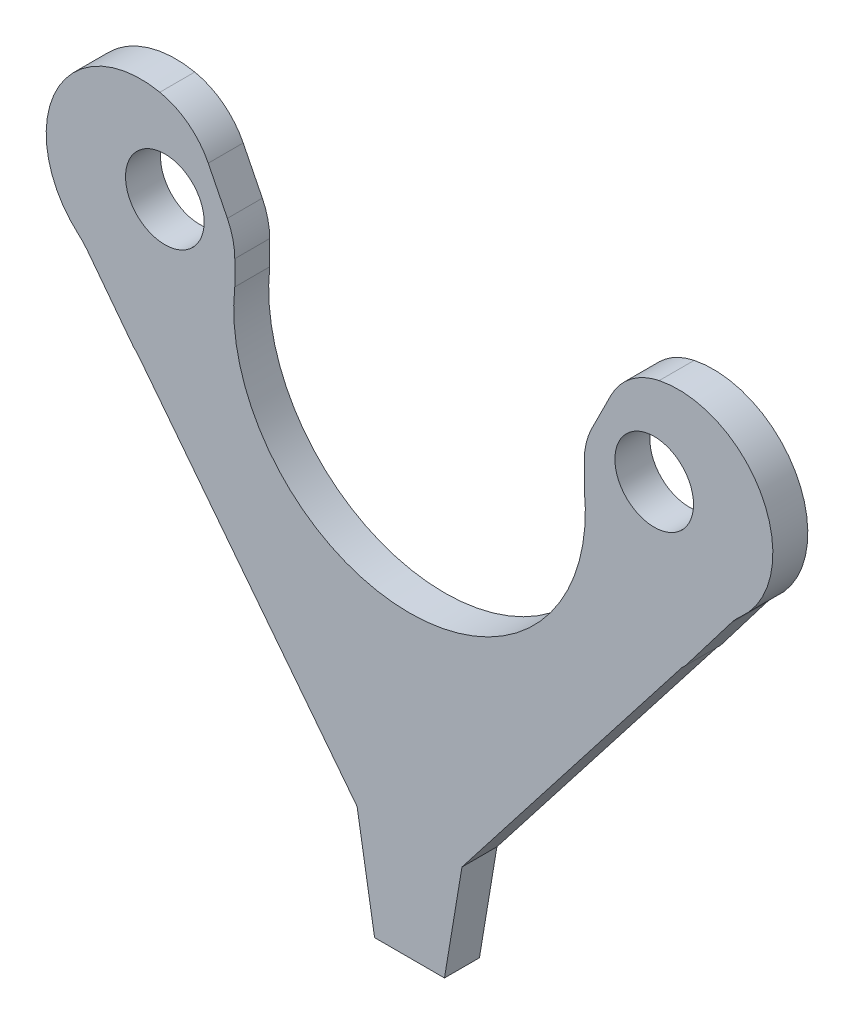
from build123d import *

# Parameters (mm, degrees)
SKETCH1_R           = 14.2875
BOSS_EXTRUDE1_DEPTH = 12.7
CUT_EXTRUDE1_REACH  = 296.425
BOSS_EXTRUDE2_DEPTH = 12.7


with BuildPart() as part:
    # Sketch1 → Boss-Extrude1 (new body)
    with BuildSketch(Plane.XY):
        with BuildLine():
            ThreePointArc((15.768991732, 19.262016535), (8.527285023, 28.043059255), (-1.822173444, 32.779908077))
            ThreePointArc((-1.822173444, 32.779908077), (-39.510935789, 14.446614644), (-31.433481123, -26.678890597))
            ThreePointArc((-31.433481123, -26.678890597), (-29.629692736, -28.429204591), (-28.007722741, -30.349221507))
            Line((-28.007722741, -30.349221507), (-11.423585695, -52.076414305))
            Line((-11.423585695, -52.076414305), (25.4, -88.9))
            Line((25.4, -88.9), (69.85, -156.121724899))
            Line((69.85, -156.121724899), (76.2, -194.221724899))
            Line((76.2, -194.221724899), (101.6, -194.221724899))
            Line((101.6, -194.221724899), (107.95, -156.121724899))
            Line((107.95, -156.121724899), (152.4, -88.9))
            Line((152.4, -88.9), (189.223585695, -52.076414305))
            Line((189.223585695, -52.076414305), (205.807722741, -30.349221507))
            ThreePointArc((205.807722741, -30.349221507), (207.429692736, -28.429204591), (209.233481123, -26.678890597))
            ThreePointArc((209.233481123, -26.678890597), (217.310935789, 14.446614644), (179.622173444, 32.779908077))
            ThreePointArc((179.622173444, 32.779908077), (169.272714977, 28.043059255), (162.031008268, 19.262016535))
            Line((162.031008268, 19.262016535), (155.081549349, 5.363098697))
            ThreePointArc((155.081549349, 5.363098697), (153.948502104, 2.736916834), (153.117891795, 0))
            ThreePointArc((153.117891795, 0), (152.580111535, -2.976652205), (152.4, -5.996126628))
            Line((152.4, -5.996126628), (152.4, -14.878975516))
            ThreePointArc((152.4, -14.878975516), (150.466540126, -24.599134698), (144.960512242, -32.839487758))
            Line((144.960512242, -32.839487758), (106.860512242, -70.939487758))
            ThreePointArc((106.860512242, -70.939487758), (88.9, -78.378975516), (70.939487758, -70.939487758))
            Line((70.939487758, -70.939487758), (32.839487758, -32.839487758))
            ThreePointArc((32.839487758, -32.839487758), (27.333459874, -24.599134698), (25.4, -14.878975516))
            Line((25.4, -14.878975516), (25.4, -5.996126628))
            ThreePointArc((25.4, -5.996126628), (24.720524332, -0.160402447), (22.718450651, 5.363098697))
            Line((22.718450651, 5.363098697), (15.768991732, 19.262016535))
        make_face()
        Circle(SKETCH1_R, mode=Mode.SUBTRACT)
        with Locations((177.8, 0)):
            Circle(SKETCH1_R, mode=Mode.SUBTRACT)
    extrude(amount=BOSS_EXTRUDE1_DEPTH)

    # Sketch2 → Cut-Extrude1 (cut, up to next)
    with BuildSketch(Plane(origin=(0, 0, 0), x_dir=(-1, 0, 0), z_dir=(0, 0, -1)), mode=Mode.PRIVATE) as cut_extrude1_sk1:
        with BuildLine():
            Line((-152.4, -14.878975516), (-25.4, -14.878975516))
            ThreePointArc((-25.4, -14.878975516), (-88.9, -85.725), (-152.4, -14.878975516))
        make_face()
    cut_extrude1_tool1 = extrude(cut_extrude1_sk1.sketch, amount=-CUT_EXTRUDE1_REACH, mode=Mode.PRIVATE) & part.part
    add(cut_extrude1_tool1.solids().sort_by_distance((88.9, -45.233395, 0))[0], mode=Mode.SUBTRACT)

    # Sketch3 → Boss-Extrude2 (add, through all)
    with BuildSketch(Plane(origin=(0, 0, 0), x_dir=(-1, 0, 0), z_dir=(0, 0, -1))):
        with BuildLine():
            Line((-205.807722741, -30.349221507), (-107.95, -156.121724899))
            Line((-107.95, -156.121724899), (-69.85, -156.121724899))
            Line((-69.85, -156.121724899), (28.007722741, -30.349221507))
            Line((28.007722741, -30.349221507), (-25.01914535, -21.84414535))
            ThreePointArc((-25.01914535, -21.84414535), (-88.9, -85.725), (-152.78085465, -21.84414535))
            Line((-152.78085465, -21.84414535), (-205.807722741, -30.349221507))
        make_face()
    extrude(amount=-BOSS_EXTRUDE2_DEPTH)


solid = part.part
